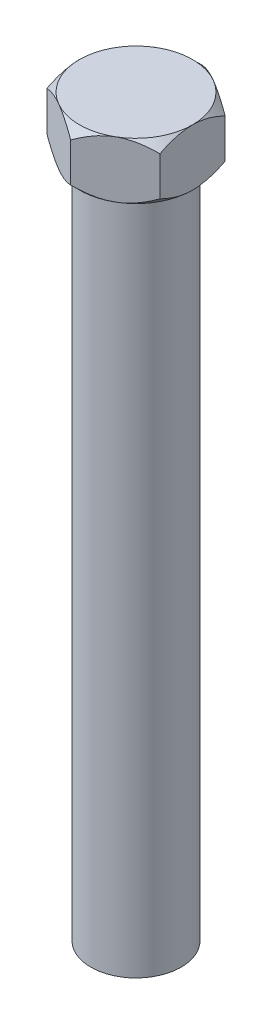
from build123d import *

# Parameters (mm, degrees)
SALIENTE_EXTRUIR1_DEPTH   = 2.5
CROQUIS3_R                = 4
SALIENTE_EXTRUIR3_DEPTH   = 60
CROQUIS4_OUTSIDE_W        = 85.354
CROQUIS4_OUTSIDE_H        = 86.902
CROQUIS4_OUTSIDE_R        = 5
CORTAR_EXTRUIR1_DEPTH     = 30
CORTAR_EXTRUIR1_DRAFT     = -45
SIMETR_A1_COPY_1_SKETCH_W = 85.354
SIMETR_A1_COPY_1_SKETCH_H = 86.902
SIMETR_A1_COPY_1_SKETCH_R = 5
SIMETR_A1_COPY_1_DEPTH    = 30
SIMETR_A1_COPY_1_DRAFT    = -45


with BuildPart() as part:
    # Croquis1 → Saliente-Extruir1 (new, symmetric)
    with BuildSketch(Plane(origin=(0, 0, 0), x_dir=(1, 0, 0), z_dir=(0, 1, 0))):
        Polygon((0, -5.773502692), (5, -2.886751346), (5, 2.886751346), (0, 5.773502692), (-5, 2.886751346), (-5, -2.886751346), align=None)
    extrude(amount=SALIENTE_EXTRUIR1_DEPTH, both=True)

    # Croquis3 → Saliente-Extruir3 (add)
    with BuildSketch(Plane.XZ.offset(2.5)):
        with Locations(Location((0, 0, 0), (0, 0, 270))):
            Circle(CROQUIS3_R)
    extrude(amount=SALIENTE_EXTRUIR3_DEPTH)


with BuildPart() as cortar_extruir1_tool:
    # Croquis4 outside → Cortar-Extruir1 (with draft: the straight prism first)
    with BuildSketch(Plane.XZ.offset(2.5)):
        Rectangle(CROQUIS4_OUTSIDE_W, CROQUIS4_OUTSIDE_H)
        Circle(CROQUIS4_OUTSIDE_R, mode=Mode.SUBTRACT)
    extrude(amount=-CORTAR_EXTRUIR1_DEPTH)
    # Cortar-Extruir1: the draft: its side faces are tilted about the plane it starts from
    cortar_extruir1_sides = [cortar_extruir1_tool.faces().sort_by_distance(p)[0] for p in [
        (0, 12.5, -43.451),
        (42.677, 12.5, 0),
        (0, 12.5, 43.451),
        (-42.677, 12.5, 0),
        (-5, 12.5, 0),
    ]]
    draft(cortar_extruir1_sides, Plane.XZ.offset(2.5), CORTAR_EXTRUIR1_DRAFT)


with BuildPart() as part_1:
    add(part.part)

    # Cortar-Extruir1: cut by cortar_extruir1_tool
    add(cortar_extruir1_tool.part, mode=Mode.SUBTRACT)


with BuildPart() as simetr_a1_copy_1_tool:
    # Simetría1 copy 1 sketch → Simetría1 copy 1 (with draft: the straight prism first)
    with BuildSketch(Plane(origin=(0, 2.5, 0), x_dir=(1, 0, 0), z_dir=(0, 1, 0))):
        Rectangle(SIMETR_A1_COPY_1_SKETCH_W, SIMETR_A1_COPY_1_SKETCH_H)
        Circle(SIMETR_A1_COPY_1_SKETCH_R, mode=Mode.SUBTRACT)
    extrude(amount=-SIMETR_A1_COPY_1_DEPTH)
    # Simetría1 copy 1: the draft: its side faces are tilted about the plane it starts from
    simetr_a1_copy_1_sides = [simetr_a1_copy_1_tool.faces().sort_by_distance(p)[0] for p in [
        (0, -12.5, -43.451),
        (42.677, -12.5, 0),
        (0, -12.5, 43.451),
        (-42.677, -12.5, 0),
        (-5, -12.5, 0),
    ]]
    draft(simetr_a1_copy_1_sides, Plane(origin=(0, 2.5, 0), x_dir=(1, 0, 0), z_dir=(0, 1, 0)), SIMETR_A1_COPY_1_DRAFT)


with BuildPart() as part_2:
    add(part_1.part)

    # Simetría1 copy 1: cut by simetr_a1_copy_1_tool
    add(simetr_a1_copy_1_tool.part, mode=Mode.SUBTRACT)


solid = part_2.part
